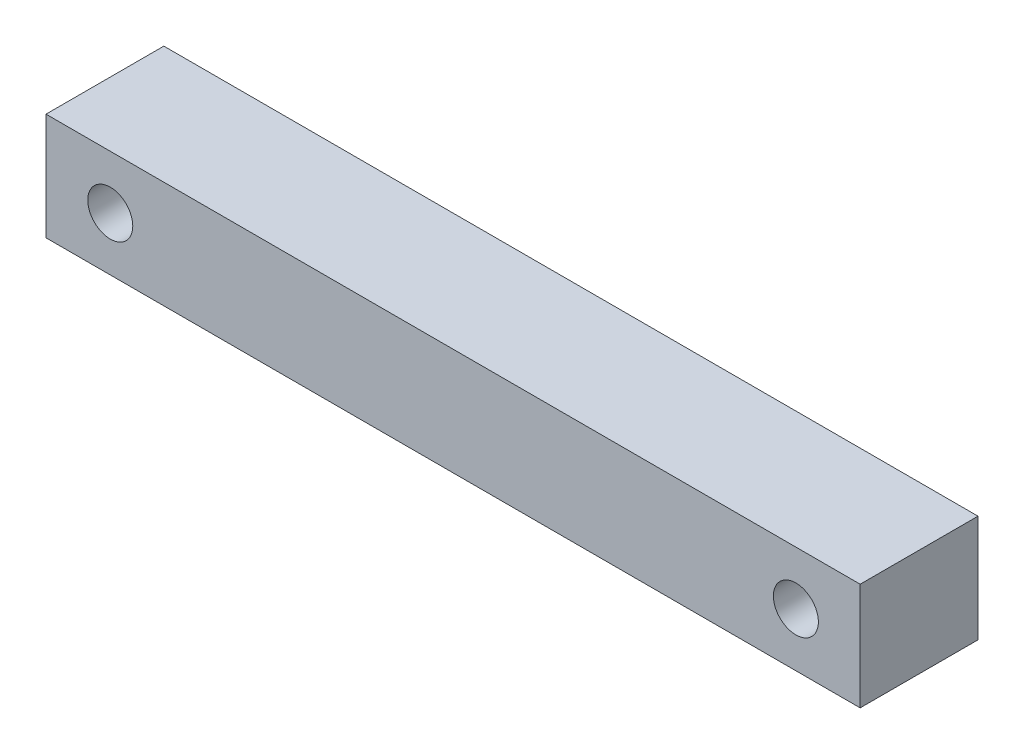
from build123d import *

# Parameters (mm, degrees)
SKETCH_1_W      = 38
SKETCH_1_H      = 5
SKETCH_1_R      = 1.05
EXTRUDE_1_DEPTH = 5.5


with BuildPart() as part:
    # ｽｹｯﾁ1 → ﾎﾞｽ - 押し出し1 (new body)
    with BuildSketch(Plane.XY):
        Rectangle(SKETCH_1_W, SKETCH_1_H)
        with Locations((-16, 0)):
            Circle(SKETCH_1_R, mode=Mode.SUBTRACT)
        with Locations((16, 0)):
            Circle(SKETCH_1_R, mode=Mode.SUBTRACT)
    extrude(amount=EXTRUDE_1_DEPTH)


solid = part.part
